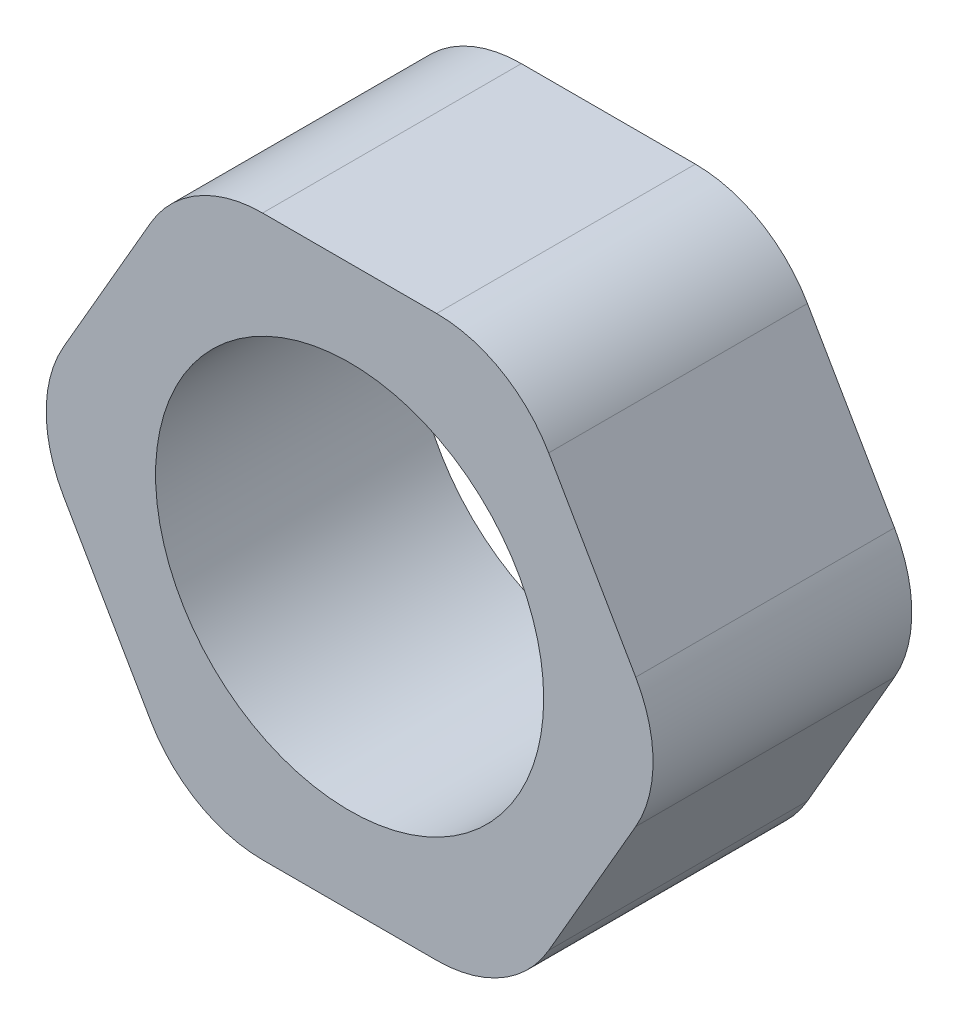
from build123d import *

# Parameters (mm, degrees)
CROQUIS1_R              = 1.5
SALIENTE_EXTRUIR1_DEPTH = 2
REDONDEO1_R             = 1


with BuildPart() as part:
    # Croquis1 → Saliente-Extruir1 (new body)
    with BuildSketch(Plane.XY):
        Polygon((1.25, 2.165063509), (-1.25, 2.165063509), (-2.5, 0), (-1.25, -2.165063509), (1.25, -2.165063509), (2.5, 0), align=None)
        Circle(CROQUIS1_R, mode=Mode.SUBTRACT)
    extrude(amount=SALIENTE_EXTRUIR1_DEPTH)

    # Redondeo1
    redondeo1_edges = [part.edges().sort_by_distance(p)[0] for p in [
        (2.5, 0, 1),
        (1.25, -2.165063509, 1),
        (-1.25, -2.165063509, 1),
        (-2.5, 0, 1),
        (-1.25, 2.165063509, 1),
        (1.25, 2.165063509, 1),
    ]]
    fillet(redondeo1_edges, radius=REDONDEO1_R)


solid = part.part
